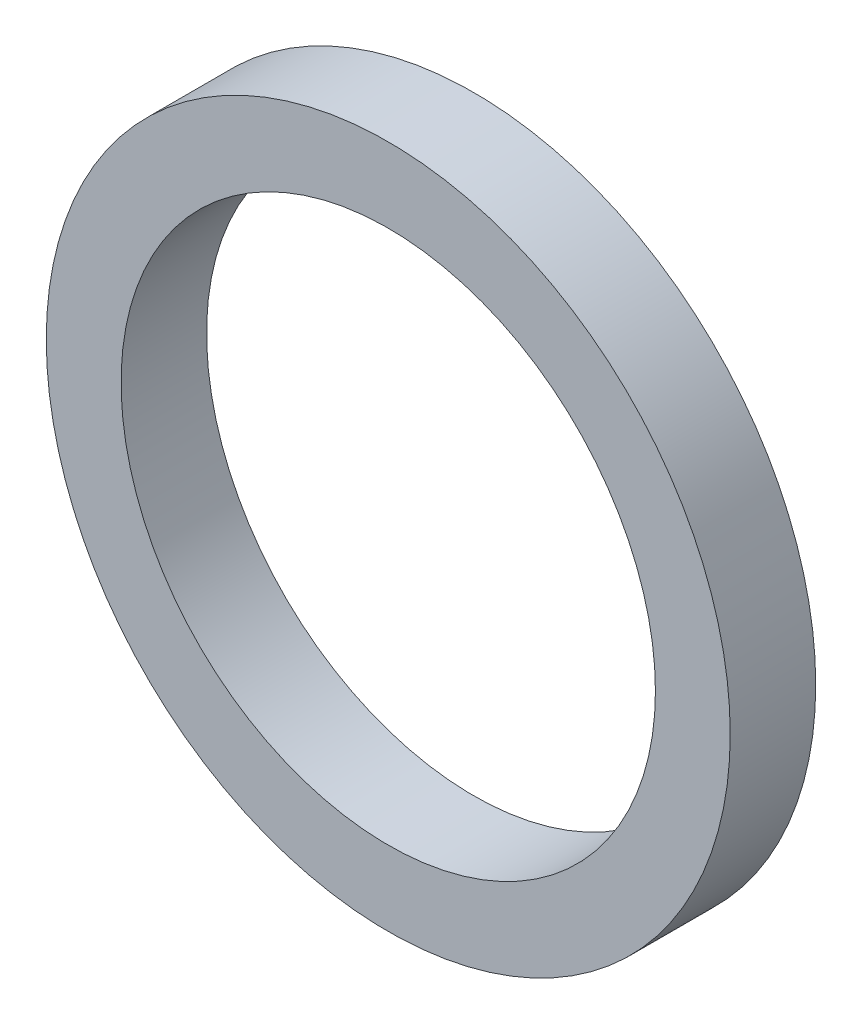
from build123d import *

# Parameters (mm, degrees)
SKETCH1_R           = 16
SKETCH1_R_2         = 12.5
BOSS_EXTRUDE1_DEPTH = 4


with BuildPart() as part:
    # Sketch1 → Boss-Extrude1 (new body)
    with BuildSketch(Plane.XY):
        Circle(SKETCH1_R)
        Circle(SKETCH1_R_2, mode=Mode.SUBTRACT)
    extrude(amount=BOSS_EXTRUDE1_DEPTH)


solid = part.part
